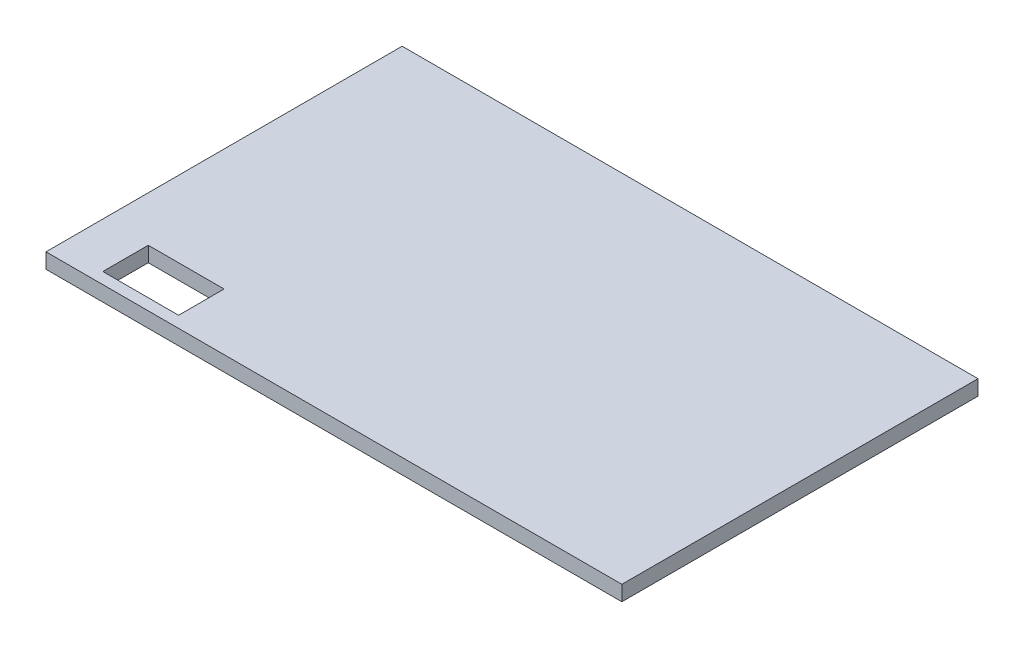
from build123d import *

# Parameters (mm, degrees)
SKETCH1_W           = 40
SKETCH1_H           = 24
BOSS_EXTRUDE1_DEPTH = 2
SKETCH2_W           = 40
SKETCH2_H           = 24
SKETCH2_W_2         = 36
SKETCH2_H_2         = 22
BOSS_EXTRUDE3_DEPTH = 8
SKETCH5_W           = 4
SKETCH5_H           = 3
CUT_EXTRUDE1_DEPTH  = 2
SKETCH6_W           = 24
SKETCH6_H           = 10
CUT_EXTRUDE2_DEPTH  = 2
SKETCH7_W           = 22
SKETCH7_H           = 8
CUT_EXTRUDE3_DEPTH  = 2
SKETCH8_W           = 1
SKETCH8_H           = 3
CUT_EXTRUDE4_DEPTH  = 2
SKETCH9_W           = 38
SKETCH9_H           = 24
CUT_EXTRUDE5_DEPTH  = 9
SKETCH10_W          = 38
SKETCH10_H          = 1
CUT_EXTRUDE6_DEPTH  = 0.25
SKETCH11_W          = 38
SKETCH11_H          = 1
CUT_EXTRUDE7_DEPTH  = 0.25


with BuildPart() as part:
    # Sketch1 → Boss-Extrude1 (new body)
    with BuildSketch(Plane(origin=(0, 0, 0), x_dir=(1, 0, 0), z_dir=(0, 1, 0))):
        with Locations((20, 12)):
            Rectangle(SKETCH1_W, SKETCH1_H)
    extrude(amount=BOSS_EXTRUDE1_DEPTH)

    # Sketch2 → Boss-Extrude3 (add)
    with BuildSketch(Plane(origin=(0, 2, 0), x_dir=(1, 0, 0), z_dir=(0, 1, 0))):
        with Locations((20, 12)):
            Rectangle(SKETCH2_W, SKETCH2_H)
        with Locations((21, 12)):
            Rectangle(SKETCH2_W_2, SKETCH2_H_2, mode=Mode.SUBTRACT)
    extrude(amount=BOSS_EXTRUDE3_DEPTH)

    # Sketch5 → Cut-Extrude1 (cut)
    with BuildSketch(Plane(origin=(0, 2, 0), x_dir=(1, 0, 0), z_dir=(0, 1, 0))):
        with Locations((6, 2.5)):
            Rectangle(SKETCH5_W, SKETCH5_H)
    extrude(amount=-CUT_EXTRUDE1_DEPTH, mode=Mode.SUBTRACT)

    # Sketch6 → Cut-Extrude2 (cut)
    with BuildSketch(Plane(origin=(40, 0, 0), x_dir=(0, 0, -1), z_dir=(1, 0, 0))):
        with Locations((12, 5)):
            Rectangle(SKETCH6_W, SKETCH6_H)
    extrude(amount=-CUT_EXTRUDE2_DEPTH, mode=Mode.SUBTRACT)

    # Sketch7 → Cut-Extrude3 (cut)
    with BuildSketch(Plane(origin=(3, 0, 0), x_dir=(0, 0, -1), z_dir=(1, 0, 0))):
        with Locations((12, 6)):
            Rectangle(SKETCH7_W, SKETCH7_H)
    extrude(amount=-CUT_EXTRUDE3_DEPTH, mode=Mode.SUBTRACT)

    # Sketch8 → Cut-Extrude4 (cut)
    with BuildSketch(Plane(origin=(0, 2, 0), x_dir=(1, 0, 0), z_dir=(0, 1, 0))):
        with Locations((3.5, 2.5)):
            Rectangle(SKETCH8_W, SKETCH8_H)
    extrude(amount=-CUT_EXTRUDE4_DEPTH, mode=Mode.SUBTRACT)

    # Sketch9 → Cut-Extrude5 (cut)
    with BuildSketch(Plane(origin=(0, 10, 0), x_dir=(1, 0, 0), z_dir=(0, 1, 0))):
        with Locations((19, 12)):
            Rectangle(SKETCH9_W, SKETCH9_H)
    extrude(amount=-CUT_EXTRUDE5_DEPTH, mode=Mode.SUBTRACT)

    # Sketch10 → Cut-Extrude6 (cut)
    with BuildSketch(Plane.XY):
        with Locations((19, 0.5)):
            Rectangle(SKETCH10_W, SKETCH10_H)
    extrude(amount=-CUT_EXTRUDE6_DEPTH, mode=Mode.SUBTRACT)

    # Sketch11 → Cut-Extrude7 (cut)
    with BuildSketch(Plane(origin=(0, 0, -24), x_dir=(-1, 0, 0), z_dir=(0, 0, -1))):
        with Locations((-19, 0.5)):
            Rectangle(SKETCH11_W, SKETCH11_H)
    extrude(amount=-CUT_EXTRUDE7_DEPTH, mode=Mode.SUBTRACT)


solid = part.part
